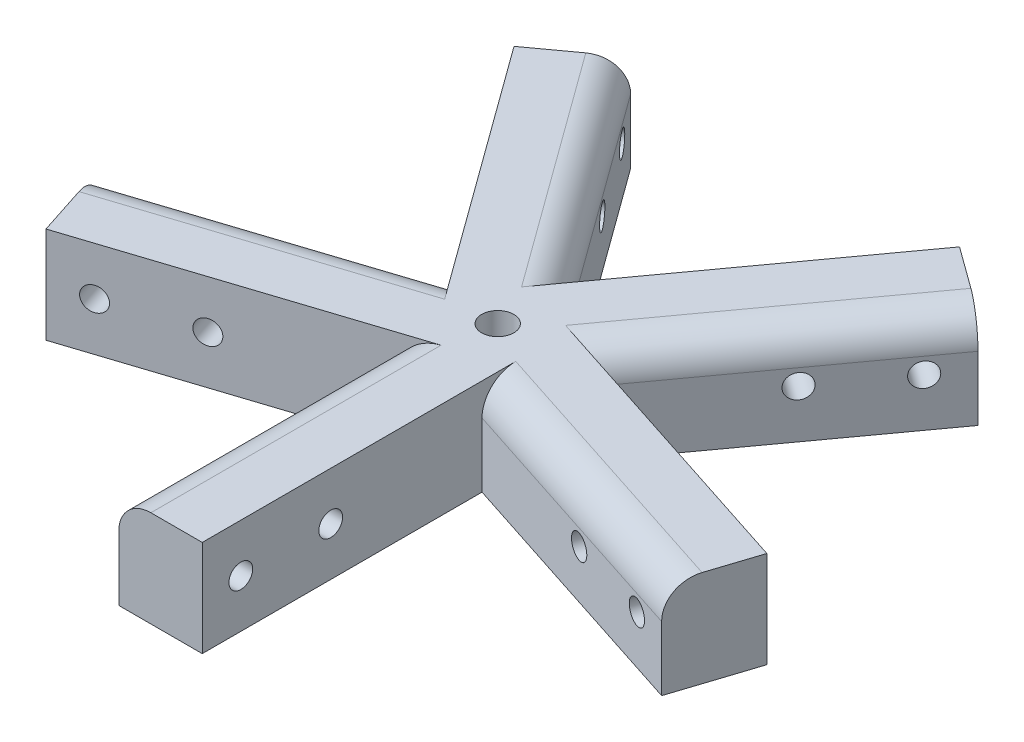
from build123d import *

# Parameters (mm, degrees)
PROTO_PENTAGRAM_R   = 7.5
PROTO_PENTAGRAM_R_2 = 2.5
BOSS_EXTRUDE1_DEPTH = 15
PICK_1_R            = 1.85
CUT_EXTRUDE1_DEPTH  = 15
PICK_2_R            = 1.85
CUT_EXTRUDE2_DEPTH  = 15
PICK_3_R            = 1.85
CUT_EXTRUDE3_DEPTH  = 15
PICK_4_R            = 1.85
CUT_EXTRUDE4_DEPTH  = 15
PICK_5_R            = 1.85
CUT_EXTRUDE5_DEPTH  = 15
FILLET1_R           = 5


with BuildPart() as part:
    # proto-pentagram → Boss-Extrude1 (new body)
    # profile 1 of 2: a face of its own
    with BuildSketch(Plane(origin=(0, 0, 0), x_dir=(1, 0, 0), z_dir=(0, 1, 0))):
        Polygon((47.921856642, -22.405259561), (6.5, -8.946482483), (6.5, -52.5), (-6.5, -52.5), (-6.5, -8.946482483), (-47.921856642, -22.405259561), (-51.939077569, -10.041524849), (-10.517220927, 3.417252229), (-36.117336209, 38.652788065), (-25.600115282, 46.293996345), (0, 11.058460509), (25.600115282, 46.293996345), (36.117336209, 38.652788065), (10.517220927, 3.417252229), (51.939077569, -10.041524849), align=None)
        Circle(PROTO_PENTAGRAM_R, mode=Mode.SUBTRACT)
    # profile 2 of 2: a face of its own
    with BuildSketch(Plane(origin=(0, 0, 0), x_dir=(1, 0, 0), z_dir=(0, 1, 0))):
        Circle(PROTO_PENTAGRAM_R)
        with Locations(Location((0, 0, 0), (0, 0, 270))):
            Circle(PROTO_PENTAGRAM_R_2, mode=Mode.SUBTRACT)
    extrude(amount=BOSS_EXTRUDE1_DEPTH)

    # pick-1 → Cut-Extrude1 (cut)
    with BuildSketch(Plane(origin=(6.5, 0, 0), x_dir=(0, 0, -1), z_dir=(1, 0, 0))):
        with Locations((-46.5, 7.5)):
            Circle(PICK_1_R)
        with Locations((-32.5, 7.5)):
            Circle(PICK_1_R)
    extrude(amount=-CUT_EXTRUDE1_DEPTH, mode=Mode.SUBTRACT)

    # pick-2 → Cut-Extrude2 (cut)
    with BuildSketch(Plane(origin=(2.008610463, 0, -6.181867356), x_dir=(-0.9510565162951501, 0, -0.3090169943749584), z_dir=(0.3090169943749584, 0, -0.9510565162951501))):
        with Locations((-46.5, 7.5)):
            Circle(PICK_2_R)
        with Locations((-32.5, 7.5)):
            Circle(PICK_2_R)
    extrude(amount=-CUT_EXTRUDE2_DEPTH, mode=Mode.SUBTRACT)

    # pick-3 → Cut-Extrude3 (cut)
    with BuildSketch(Plane(origin=(-5.258610463, 0, -3.82060414), x_dir=(-0.5877852522924804, 0, 0.8090169943749422), z_dir=(-0.8090169943749423, 0, -0.5877852522924804))):
        with Locations((-46.5, 7.5)):
            Circle(PICK_3_R)
        with Locations((-32.5, 7.5)):
            Circle(PICK_3_R)
    extrude(amount=-CUT_EXTRUDE3_DEPTH, mode=Mode.SUBTRACT)

    # pick-4 → Cut-Extrude4 (cut)
    with BuildSketch(Plane(origin=(-5.258610463, 0, 3.82060414), x_dir=(0.5877852522924687, 0, 0.8090169943749507), z_dir=(-0.8090169943749508, 0, 0.5877852522924687))):
        with Locations((-46.5, 7.5)):
            Circle(PICK_4_R)
        with Locations((-32.5, 7.5)):
            Circle(PICK_4_R)
    extrude(amount=-CUT_EXTRUDE4_DEPTH, mode=Mode.SUBTRACT)

    # pick-5 → Cut-Extrude5 (cut)
    with BuildSketch(Plane(origin=(2.008610463, 0, 6.181867356), x_dir=(0.9510565162951544, 0, -0.30901699437494484), z_dir=(0.30901699437494484, 0, 0.9510565162951544))):
        with Locations((-46.5, 7.5)):
            Circle(PICK_5_R)
        with Locations((-32.5, 7.5)):
            Circle(PICK_5_R)
    extrude(amount=-CUT_EXTRUDE5_DEPTH, mode=Mode.SUBTRACT)

    # Fillet1
    fillet1_edges = [part.edges().sort_by_distance(p)[0] for p in [
        (23.317278568, 15, -21.035020147),
        (-12.800057641, 15, -28.676228427),
        (27.210928321, 15, 15.675871022),
        (-31.228149248, 15, 3.31213631),
        (-6.5, 15, 30.723241242),
    ]]
    fillet(fillet1_edges, radius=FILLET1_R)


solid = part.part
